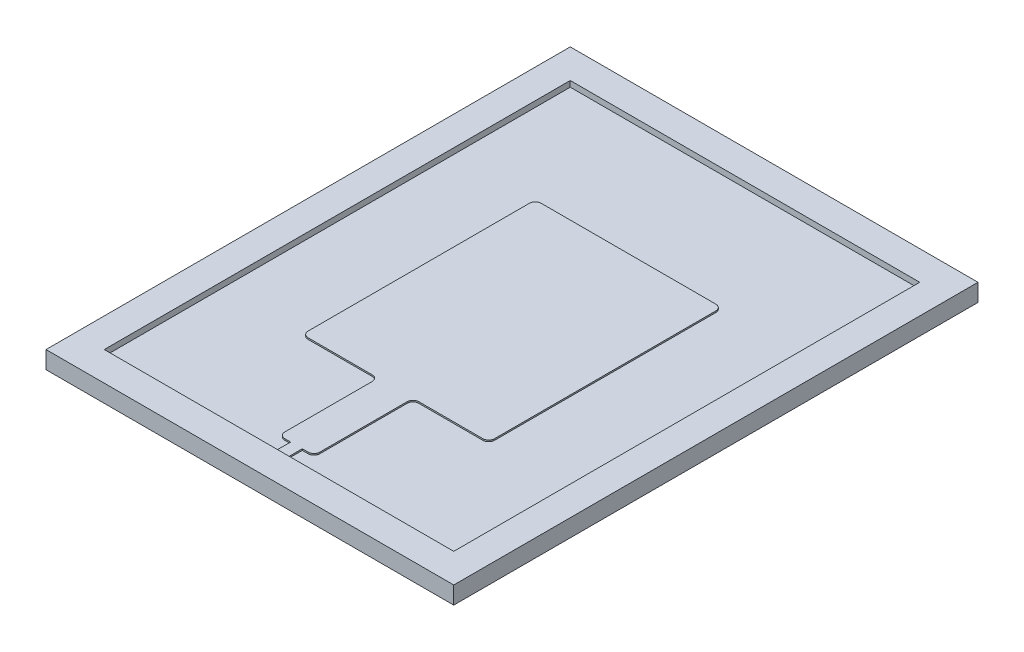
from build123d import *

# Parameters (mm, degrees)
SKETCH1_W           = 35
SKETCH1_H           = 45
BOSS_EXTRUDE1_DEPTH = 1.5
SKETCH2_W           = 30
SKETCH2_H           = 40
CUT_EXTRUDE1_DEPTH  = 0.5
BOSS_EXTRUDE2_DEPTH = 0.125


with BuildPart() as part:
    # Sketch1 → Boss-Extrude1 (new body)
    with BuildSketch(Plane(origin=(0, 0, 0), x_dir=(1, 0, 0), z_dir=(0, 1, 0))):
        Rectangle(SKETCH1_W, SKETCH1_H)
    extrude(amount=BOSS_EXTRUDE1_DEPTH)

    # Sketch2 → Cut-Extrude1 (cut)
    with BuildSketch(Plane(origin=(0, 1.5, 0), x_dir=(1, 0, 0), z_dir=(0, 1, 0))):
        Rectangle(SKETCH2_W, SKETCH2_H)
    extrude(amount=-CUT_EXTRUDE1_DEPTH, mode=Mode.SUBTRACT)

    # Sketch3 → Boss-Extrude2 (add)
    with BuildSketch(Plane(origin=(0, 1, 0), x_dir=(1, 0, 0), z_dir=(0, 1, 0))):
        with BuildLine():
            Line((-1.5, -10.5), (-1.5, -18))
            ThreePointArc((-1.5, -18), (-1.353553391, -18.353553391), (-1, -18.5))
            Line((-1, -18.5), (-0.5, -18.5))
            Line((-0.5, -18.5), (-0.5, -20))
            Line((-0.5, -20), (0.5, -20))
            Line((0.5, -20), (0.5, -18.5))
            Line((0.5, -18.5), (1, -18.5))
            ThreePointArc((1, -18.5), (1.353553391, -18.353553391), (1.5, -18))
            Line((1.5, -18), (1.5, -10.5))
            ThreePointArc((1.5, -10.5), (1.646446609, -10.146446609), (2, -10))
            Line((2, -10), (7.5, -10))
            ThreePointArc((7.5, -10), (7.853553391, -9.853553391), (8, -9.5))
            Line((8, -9.5), (8, 9.5))
            ThreePointArc((8, 9.5), (7.853553391, 9.853553391), (7.5, 10))
            Line((7.5, 10), (-7.5, 10))
            ThreePointArc((-7.5, 10), (-7.853553391, 9.853553391), (-8, 9.5))
            Line((-8, 9.5), (-8, -9.5))
            ThreePointArc((-8, -9.5), (-7.853553391, -9.853553391), (-7.5, -10))
            Line((-7.5, -10), (-2, -10))
            ThreePointArc((-2, -10), (-1.646446609, -10.146446609), (-1.5, -10.5))
        make_face()
    extrude(amount=BOSS_EXTRUDE2_DEPTH)


solid = part.part
